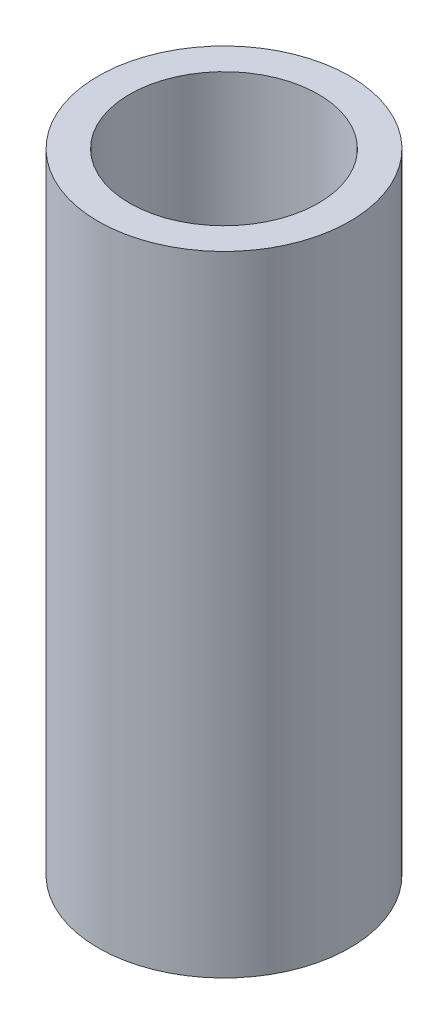
from build123d import *

# Parameters (mm, degrees)
SKETCH1_R          = 20
SKETCH1_R_2        = 15
BASECYLINDER_DEPTH = 100


with BuildPart() as part:
    # Sketch1 → BaseCylinder (new body)
    with BuildSketch(Plane(origin=(0, 0, 0), x_dir=(1, 0, 0), z_dir=(0, 1, 0))):
        with Locations(Location((0, 0, 0), (0, 0, 270))):
            Circle(SKETCH1_R)
        with Locations(Location((0, 0, 0), (0, 0, 270))):
            Circle(SKETCH1_R_2, mode=Mode.SUBTRACT)
    extrude(amount=BASECYLINDER_DEPTH)


solid = part.part
